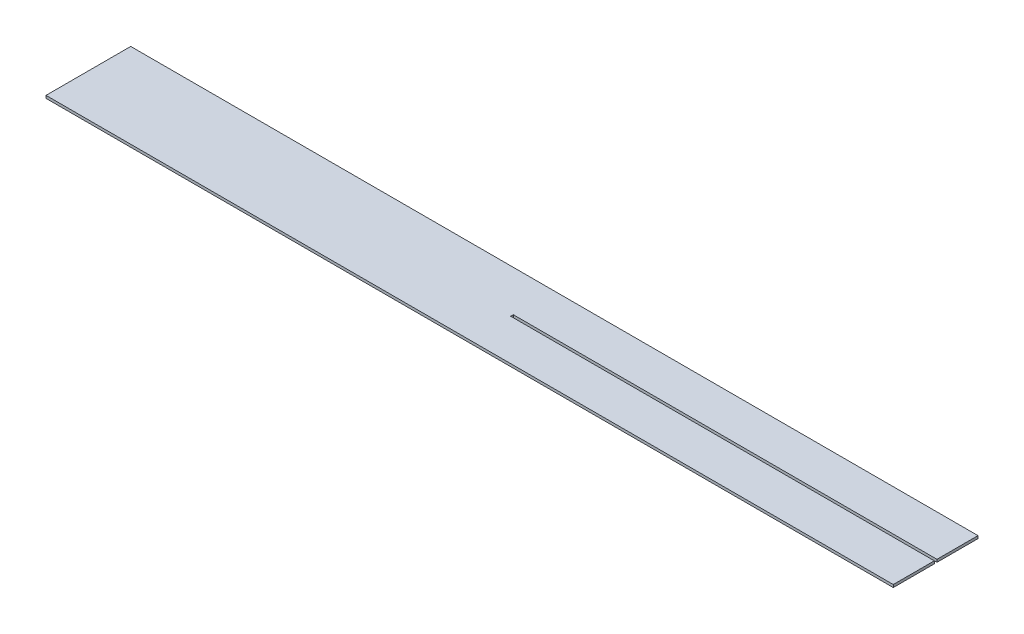
from build123d import *

# Parameters (mm, degrees)
BOSS_EXTRUDE1_DEPTH = 1.5875


with BuildPart() as part:
    # Sketch1 → Boss-Extrude1 (new body)
    with BuildSketch(Plane(origin=(0, 0, 0), x_dir=(1, 0, 0), z_dir=(0, 1, 0))):
        Polygon((-254, 25.4), (-254, -25.4), (254, -25.4), (254, -0.79375), (0, -0.79375), (0, 0.79375), (254, 0.79375), (254, 25.4), align=None)
    extrude(amount=BOSS_EXTRUDE1_DEPTH)


solid = part.part
